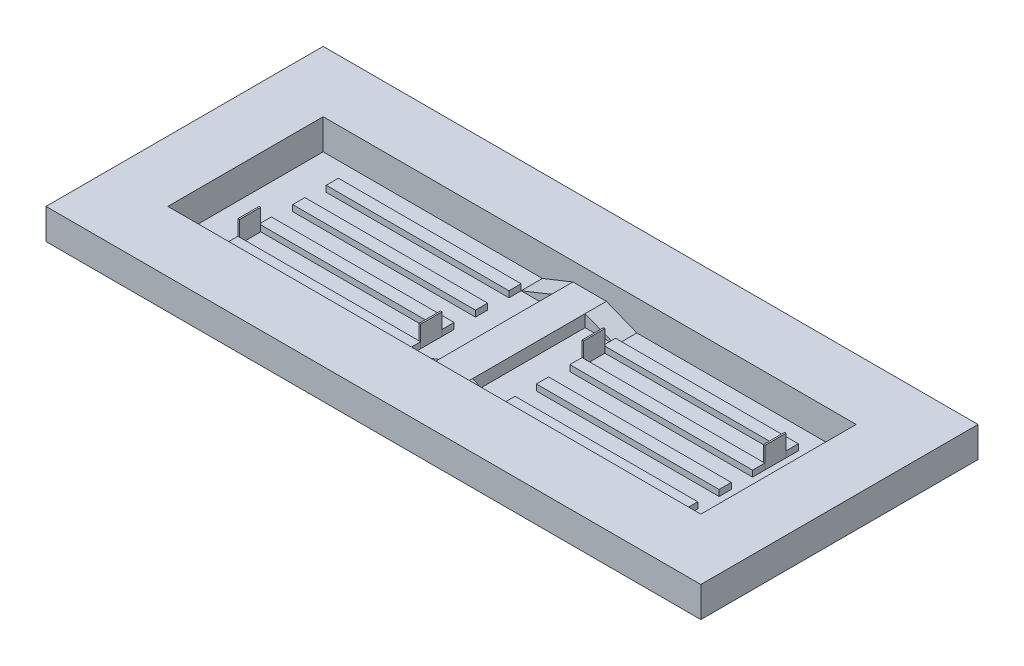
from build123d import *

# Parameters (mm, degrees)
SKETCH_1_W          = 21500
SKETCH_1_H          = 9100
EXTRUDE_1_DEPTH     = 1000
SKETCH_2_W          = 17500
SKETCH_2_H          = 5100
CUT_EXTRUDE_2_DEPTH = 999
SKETCH_3_W          = 1100
SKETCH_3_H          = 5100
EXTRUDE_3_DEPTH     = 400
EXTRUDE_4_DEPTH     = 700
EXTRUDE_5_DEPTH     = 700
SKETCH_7_W          = 6000
SKETCH_7_H          = 400
EXTRUDE_6_DEPTH     = 200
SKETCH_9_W          = 50
SKETCH_9_H          = 700
EXTRUDE_7_DEPTH     = 700
EXTRUDE_7_2_DEPTH   = 700
EXTRUDE_7_3_DEPTH   = 700
EXTRUDE_7_4_DEPTH   = 700


with BuildPart() as part:
    # 草圖1 → 伸長1 (new body)
    with BuildSketch(Plane(origin=(0, 0, 0), x_dir=(1, 0, 0), z_dir=(0, 1, 0))):
        Rectangle(SKETCH_1_W, SKETCH_1_H)
    extrude(amount=EXTRUDE_1_DEPTH)

    # 草圖2 → 伸長2 (cut)
    with BuildSketch(Plane(origin=(0, 1000, 0), x_dir=(1, 0, 0), z_dir=(0, 1, 0))):
        Rectangle(SKETCH_2_W, SKETCH_2_H)
    extrude(amount=-CUT_EXTRUDE_2_DEPTH, mode=Mode.SUBTRACT)

    # 草圖3 → 伸長3 (add)
    with BuildSketch(Plane(origin=(0, 1, 0), x_dir=(1, 0, 0), z_dir=(0, 1, 0))):
        Rectangle(SKETCH_3_W, SKETCH_3_H)
    extrude(amount=EXTRUDE_3_DEPTH)

    # 草圖5 → 伸長4 (add)
    with BuildSketch(Plane.XY.offset(-2550)):
        Polygon((550, 401), (1550, 1), (550, 1), align=None)
        Polygon((-550, 1), (-550, 401), (-1550, 1), align=None)
    extrude(amount=EXTRUDE_4_DEPTH)

    # 草圖6 → 伸長5 (add)
    with BuildSketch(Plane(origin=(0, 0, 2550), x_dir=(-1, 0, 0), z_dir=(0, 0, -1))):
        Polygon((-550, 1), (-550, 401), (-1550, 1), align=None)
        Polygon((550, 1), (550, 401), (1550, 1), align=None)
    extrude(amount=EXTRUDE_5_DEPTH)

    # 草圖7 → 伸長6 (add)
    with BuildSketch(Plane(origin=(0, 1, 0), x_dir=(1, 0, 0), z_dir=(0, 1, 0))):
        with Locations((4550, 1650)):
            Rectangle(SKETCH_7_W, SKETCH_7_H)
        with Locations((4550, -1650)):
            Rectangle(SKETCH_7_W, SKETCH_7_H)
        with Locations((4550, 550)):
            Rectangle(SKETCH_7_W, SKETCH_7_H)
        with Locations((4550, -550)):
            Rectangle(SKETCH_7_W, SKETCH_7_H)
    extrude_6 = extrude(amount=EXTRUDE_6_DEPTH)

    # 鏡射1: 伸長6 across plane
    add(extrude_6.mirror(Plane(origin=(0, 0, 0), x_dir=(0, 0, 1), z_dir=(1, 0, 0))))


with BuildPart() as body_2:
    # 草圖9 → 伸長7 (new body)
    with BuildSketch(Plane(origin=(0, 1, 0), x_dir=(1, 0, 0), z_dir=(0, 1, 0))):
        with Locations((-7525, -1100)):
            Rectangle(SKETCH_9_W, SKETCH_9_H)
    extrude(amount=EXTRUDE_7_DEPTH)


with BuildPart() as body_3:
    # 草圖9 → Extrude 7 2 (new body)
    with BuildSketch(Plane(origin=(0, 1, 0), x_dir=(1, 0, 0), z_dir=(0, 1, 0))):
        with Locations((7525, 1100)):
            Rectangle(SKETCH_9_W, SKETCH_9_H)
    extrude(amount=EXTRUDE_7_2_DEPTH)


with BuildPart() as body_4:
    # 草圖9 → Extrude 7 3 (new body)
    with BuildSketch(Plane(origin=(0, 1, 0), x_dir=(1, 0, 0), z_dir=(0, 1, 0))):
        with Locations((-1575, -1100)):
            Rectangle(SKETCH_9_W, SKETCH_9_H)
    extrude(amount=EXTRUDE_7_3_DEPTH)


with BuildPart() as body_5:
    # 草圖9 → Extrude 7 4 (new body)
    with BuildSketch(Plane(origin=(0, 1, 0), x_dir=(1, 0, 0), z_dir=(0, 1, 0))):
        with Locations((1575, 1100)):
            Rectangle(SKETCH_9_W, SKETCH_9_H)
    extrude(amount=EXTRUDE_7_4_DEPTH)


solid = Compound([part.part, body_2.part, body_3.part, body_4.part, body_5.part])
